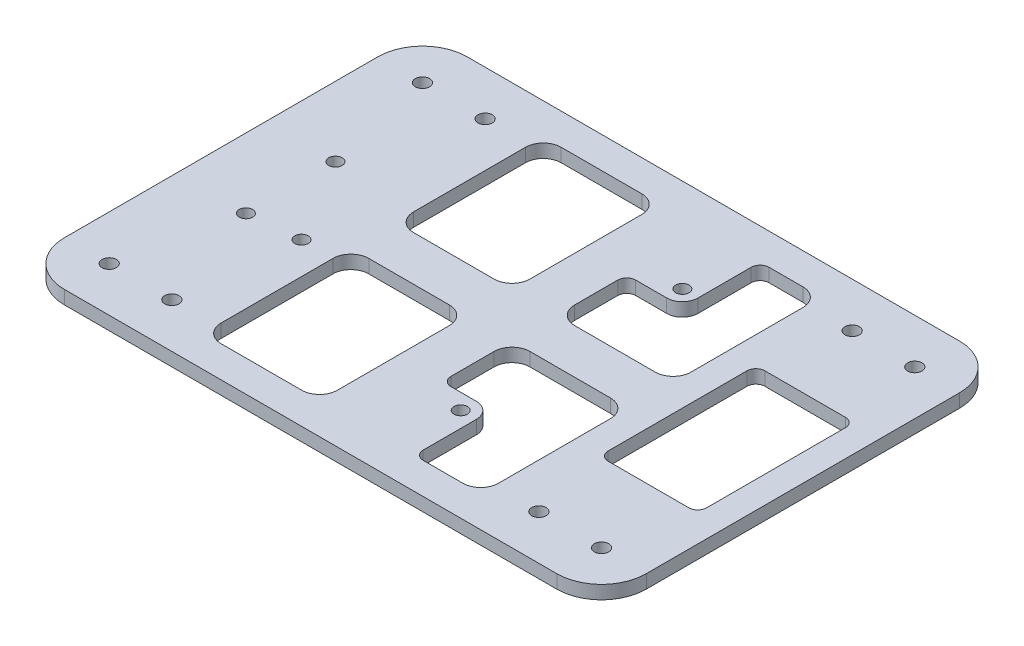
from build123d import *

# Parameters (mm, degrees)
SKETCH2_W           = 130
SKETCH2_H           = 90
BOSS_EXTRUDE1_DEPTH = 3
SKETCH3_R           = 1.5
CUT_EXTRUDE1_DEPTH  = 10
SKETCH4_R           = 1.6
CUT_EXTRUDE2_DEPTH  = 10
FILLET1_R           = 10
CUT_EXTRUDE3_DEPTH  = 10
SKETCH6_R           = 1.5
BOSS_EXTRUDE4_DEPTH = 3
SKETCH6_6_R         = 1.5
CUT_EXTRUDE4_DEPTH  = 3
SKETCH8_R           = 1.5
CUT_EXTRUDE5_DEPTH  = 10
SKETCH9_W           = 22
SKETCH9_H           = 35
CUT_EXTRUDE6_DEPTH  = 10
FILLET2_R           = 2


with BuildPart() as part:
    # Sketch2 → Boss-Extrude1 (new body)
    with BuildSketch(Plane(origin=(0, 0, 0), x_dir=(1, 0, 0), z_dir=(0, 1, 0))):
        with Locations((71.271186441, 55.564971751)):
            Rectangle(SKETCH2_W, SKETCH2_H)
    extrude(amount=-BOSS_EXTRUDE1_DEPTH)

    # Sketch3 → Cut-Extrude1 (cut)
    with BuildSketch(Plane(origin=(0, 0, 0), x_dir=(1, 0, 0), z_dir=(0, 1, 0))):
        with Locations(Location((126.271186441, 63.564971751, 0), (0, 0, 270))):
            Circle(SKETCH3_R)
        with Locations(Location((126.271186441, 47.564971751, 0), (0, 0, 270))):
            Circle(SKETCH3_R)
        with Locations(Location((112.271186441, 47.564971751, 0), (0, 0, 270))):
            Circle(SKETCH3_R)
        with Locations(Location((112.271186441, 63.564971751, 0), (0, 0, 270))):
            Circle(SKETCH3_R)
        with Locations(Location((16.271186441, 47.564971751, 0), (0, 0, 90))):
            Circle(SKETCH3_R)
        with Locations(Location((30.271186441, 47.564971751, 0), (0, 0, 90))):
            Circle(SKETCH3_R)
        with Locations(Location((16.271186441, 63.564971751, 0), (0, 0, 90))):
            Circle(SKETCH3_R)
        with Locations(Location((30.271186441, 63.564971751, 0), (0, 0, 90))):
            Circle(SKETCH3_R)
    extrude(amount=-CUT_EXTRUDE1_DEPTH, mode=Mode.SUBTRACT)

    # Sketch4 → Cut-Extrude2 (cut)
    with BuildSketch(Plane(origin=(0, 0, 0), x_dir=(1, 0, 0), z_dir=(0, 1, 0))):
        with Locations(Location((16.271186441, 20.564971751, 0), (0, 0, 270))):
            Circle(SKETCH4_R)
        with Locations(Location((30.271186441, 20.564971751, 0), (0, 0, 270))):
            Circle(SKETCH4_R)
        with Locations(Location((30.271186441, 90.564971751, 0), (0, 0, 90))):
            Circle(SKETCH4_R)
        with Locations(Location((16.271186441, 90.564971751, 0), (0, 0, 90))):
            Circle(SKETCH4_R)
        with Locations(Location((112.271186441, 20.564971751, 0), (0, 0, 90))):
            Circle(SKETCH4_R)
        with Locations(Location((126.271186441, 20.564971751, 0), (0, 0, 90))):
            Circle(SKETCH4_R)
        with Locations(Location((126.271186441, 90.564971751, 0), (0, 0, 270))):
            Circle(SKETCH4_R)
        with Locations(Location((112.271186441, 90.564971751, 0), (0, 0, 270))):
            Circle(SKETCH4_R)
    extrude(amount=-CUT_EXTRUDE2_DEPTH, mode=Mode.SUBTRACT)

    # Fillet1
    fillet1_edges = [part.edges().sort_by_distance(p)[0] for p in [
        (6.271186441, -1.5, -100.564971751),
        (136.271186441, -1.5, -100.564971751),
        (136.271186441, -1.5, -10.564971751),
        (6.271186441, -1.5, -10.564971751),
    ]]
    fillet(fillet1_edges, radius=FILLET1_R)

    # Sketch5 → Cut-Extrude3 (cut)
    with BuildSketch(Plane(origin=(0, 0, 0), x_dir=(1, 0, 0), z_dir=(0, 1, 0))):
        with BuildLine():
            Line((76.271186441, 89.564971751), (76.271186441, 64.564971751))
            ThreePointArc((76.271186441, 64.564971751), (77.442759316, 61.736544627), (80.271186441, 60.564971751))
            Line((80.271186441, 60.564971751), (98.271186441, 60.564971751))
            ThreePointArc((98.271186441, 60.564971751), (101.099613565, 61.736544627), (102.271186441, 64.564971751))
            Line((102.271186441, 64.564971751), (102.271186441, 89.564971751))
            ThreePointArc((102.271186441, 89.564971751), (101.099613565, 92.393398876), (98.271186441, 93.564971751))
            Line((98.271186441, 93.564971751), (80.271186441, 93.564971751))
            ThreePointArc((80.271186441, 93.564971751), (77.442759316, 92.393398876), (76.271186441, 89.564971751))
        make_face()
        with BuildLine():
            Line((40.271186441, 89.564971751), (40.271186441, 64.564971751))
            ThreePointArc((40.271186441, 64.564971751), (41.442759316, 61.736544627), (44.271186441, 60.564971751))
            Line((44.271186441, 60.564971751), (62.271186441, 60.564971751))
            ThreePointArc((62.271186441, 60.564971751), (65.099613565, 61.736544627), (66.271186441, 64.564971751))
            Line((66.271186441, 64.564971751), (66.271186441, 89.564971751))
            ThreePointArc((66.271186441, 89.564971751), (65.099613565, 92.393398876), (62.271186441, 93.564971751))
            Line((62.271186441, 93.564971751), (44.271186441, 93.564971751))
            ThreePointArc((44.271186441, 93.564971751), (41.442759316, 92.393398876), (40.271186441, 89.564971751))
        make_face()
        with BuildLine():
            Line((66.271186441, 21.564971751), (66.271186441, 46.564971751))
            ThreePointArc((66.271186441, 46.564971751), (65.099613565, 49.393398876), (62.271186441, 50.564971751))
            Line((62.271186441, 50.564971751), (44.271186441, 50.564971751))
            ThreePointArc((44.271186441, 50.564971751), (41.442759316, 49.393398876), (40.271186441, 46.564971751))
            Line((40.271186441, 46.564971751), (40.271186441, 21.564971751))
            ThreePointArc((40.271186441, 21.564971751), (41.442759316, 18.736544627), (44.271186441, 17.564971751))
            Line((44.271186441, 17.564971751), (62.271186441, 17.564971751))
            ThreePointArc((62.271186441, 17.564971751), (65.099613565, 18.736544627), (66.271186441, 21.564971751))
        make_face()
        with BuildLine():
            Line((102.271186441, 21.564971751), (102.271186441, 46.564971751))
            ThreePointArc((102.271186441, 46.564971751), (101.099613565, 49.393398876), (98.271186441, 50.564971751))
            Line((98.271186441, 50.564971751), (80.271186441, 50.564971751))
            ThreePointArc((80.271186441, 50.564971751), (77.442759316, 49.393398876), (76.271186441, 46.564971751))
            Line((76.271186441, 46.564971751), (76.271186441, 21.564971751))
            ThreePointArc((76.271186441, 21.564971751), (77.442759316, 18.736544627), (80.271186441, 17.564971751))
            Line((80.271186441, 17.564971751), (98.271186441, 17.564971751))
            ThreePointArc((98.271186441, 17.564971751), (101.099613565, 18.736544627), (102.271186441, 21.564971751))
        make_face()
    extrude(amount=-CUT_EXTRUDE3_DEPTH, mode=Mode.SUBTRACT)

    # Sketch6 → Boss-Extrude4 (add)
    # profile 1 of 10: a face of its own
    with BuildSketch(Plane(origin=(0, 0, 0), x_dir=(1, 0, 0), z_dir=(0, 1, 0))):
        with BuildLine():
            Line((87.436129721, 17.564971751), (87.436129721, 31.434971751))
            ThreePointArc((87.436129721, 31.434971751), (86.411003455, 33.909845486), (83.936129721, 34.934971751))
            Line((83.936129721, 34.934971751), (76.271186441, 34.934971751))
            Line((76.271186441, 34.934971751), (76.271186441, 17.564971751))
            Line((76.271186441, 17.564971751), (87.436129721, 17.564971751))
        make_face()
        with Locations(Location((83.936129721, 31.434971751, 0), (0, 0, 270))):
            Circle(SKETCH6_R, mode=Mode.SUBTRACT)
    # profile 2 of 10: a face of its own
    with BuildSketch(Plane(origin=(0, 0, 0), x_dir=(1, 0, 0), z_dir=(0, 1, 0))):
        with BuildLine():
            Line((88.706129721, 79.694971751), (88.706129721, 93.564971751))
            Line((88.706129721, 93.564971751), (76.271186441, 93.564971751))
            Line((76.271186441, 93.564971751), (76.271186441, 76.194971751))
            Line((76.271186441, 76.194971751), (85.206129721, 76.194971751))
            ThreePointArc((85.206129721, 76.194971751), (87.681003455, 77.220098017), (88.706129721, 79.694971751))
        make_face()
        with Locations(Location((85.206129721, 79.694971751, 0), (0, 0, 270))):
            Circle(SKETCH6_R, mode=Mode.SUBTRACT)
    # profile 3 of 10: a face of its own
    with BuildSketch(Plane(origin=(0, 0, 0), x_dir=(1, 0, 0), z_dir=(0, 1, 0))):
        with Locations((30.271186441, 47.564971751)):
            Circle(SKETCH6_R)
    # profile 4 of 10: a face of its own
    with BuildSketch(Plane(origin=(0, 0, 0), x_dir=(1, 0, 0), z_dir=(0, 1, 0))):
        with Locations((16.271186441, 47.564971751)):
            Circle(SKETCH6_R)
    # profile 5 of 10: a face of its own
    with BuildSketch(Plane(origin=(0, 0, 0), x_dir=(1, 0, 0), z_dir=(0, 1, 0))):
        with Locations((16.271186441, 63.564971751)):
            Circle(SKETCH6_R)
    # profile 6 of 10: a face of its own
    with BuildSketch(Plane(origin=(0, 0, 0), x_dir=(1, 0, 0), z_dir=(0, 1, 0))):
        with Locations((30.271186441, 63.564971751)):
            Circle(SKETCH6_R)
    # profile 7 of 10: a face of its own
    with BuildSketch(Plane(origin=(0, 0, 0), x_dir=(1, 0, 0), z_dir=(0, 1, 0))):
        with Locations((112.271186441, 47.564971751)):
            Circle(SKETCH6_R)
    # profile 8 of 10: a face of its own
    with BuildSketch(Plane(origin=(0, 0, 0), x_dir=(1, 0, 0), z_dir=(0, 1, 0))):
        with Locations((112.271186441, 63.564971751)):
            Circle(SKETCH6_R)
    # profile 9 of 10: a face of its own
    with BuildSketch(Plane(origin=(0, 0, 0), x_dir=(1, 0, 0), z_dir=(0, 1, 0))):
        with Locations((126.271186441, 63.564971751)):
            Circle(SKETCH6_R)
    # profile 10 of 10: a face of its own
    with BuildSketch(Plane(origin=(0, 0, 0), x_dir=(1, 0, 0), z_dir=(0, 1, 0))):
        with Locations((126.271186441, 47.564971751)):
            Circle(SKETCH6_R)
    extrude(amount=-BOSS_EXTRUDE4_DEPTH)

    # Sketch6<6> → Cut-Extrude4 (cut)
    with BuildSketch(Plane(origin=(0, 0, 0), x_dir=(1, 0, 0), z_dir=(0, 1, 0))):
        with Locations(Location((33.136129721, 46.674971751, 0), (0, 0, 270))):
            Circle(SKETCH6_6_R)
    extrude(amount=-CUT_EXTRUDE4_DEPTH, mode=Mode.SUBTRACT)

    # Sketch8 → Cut-Extrude5 (cut)
    with BuildSketch(Plane(origin=(0, 0, 0), x_dir=(1, 0, 0), z_dir=(0, 1, 0))):
        with Locations(Location((21.821186441, 65.564971751, 0), (0, 0, 270))):
            Circle(SKETCH8_R)
        with Locations(Location((21.821186441, 45.564971751, 0), (0, 0, 270))):
            Circle(SKETCH8_R)
    extrude(amount=-CUT_EXTRUDE5_DEPTH, mode=Mode.SUBTRACT)

    # Sketch9 → Cut-Extrude6 (cut)
    with BuildSketch(Plane(origin=(0, 0, 0), x_dir=(1, 0, 0), z_dir=(0, 1, 0))):
        with Locations((119.271186441, 55.564971751)):
            Rectangle(SKETCH9_W, SKETCH9_H)
    extrude(amount=-CUT_EXTRUDE6_DEPTH, mode=Mode.SUBTRACT)

    # Fillet2
    fillet2_edges = [part.edges().sort_by_distance(p)[0] for p in [
        (76.271186441, -1.5, -76.194971751),
        (88.706129721, -1.5, -93.564971751),
        (87.436129721, -1.5, -17.564971751),
        (76.271186441, -1.5, -34.934971751),
        (108.271186441, -1.5, -38.064971751),
        (108.271186441, -1.5, -73.064971751),
        (130.271186441, -1.5, -73.064971751),
        (130.271186441, -1.5, -38.064971751),
    ]]
    fillet(fillet2_edges, radius=FILLET2_R)


solid = part.part
